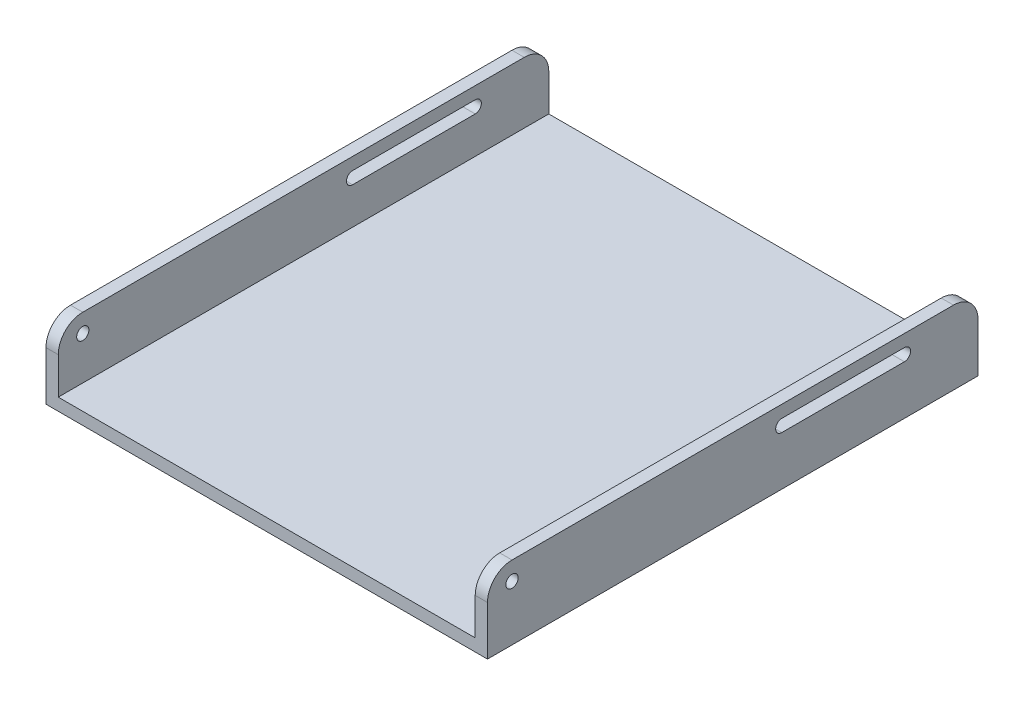
from build123d import *

# Parameters (mm, degrees)
EXTRUDE_THIN1_DEPTH = 200
CUT_EXTRUDE1_DEPTH  = 364
FILLET1_R           = 20
SKETCH3_R           = 5
CUT_EXTRUDE2_DEPTH  = 417.173040934


with BuildPart() as part:
    # Sketch1 → Extrude-Thin1 (new, symmetric)
    with BuildSketch(Plane.XY):
        Polygon((-150, 60), (-150, 0), (210, 0), (210, 60), (200, 60), (200, 10), (-140, 10), (-140, 60), align=None)
    extrude(amount=EXTRUDE_THIN1_DEPTH, both=True)

    # Sketch2 → Cut-Extrude1 (cut)
    with BuildSketch(Plane(origin=(210, 0, 0), x_dir=(0, 0, -1), z_dir=(1, 0, 0))):
        with BuildLine():
            Line((40, 50), (140, 50))
            ThreePointArc((140, 50), (145, 45), (140, 40))
            Line((140, 40), (40, 40))
            ThreePointArc((40, 40), (35, 45), (40, 50))
        make_face()
    extrude(amount=-CUT_EXTRUDE1_DEPTH, mode=Mode.SUBTRACT)

    # Fillet1
    fillet1_edges = [part.edges().sort_by_distance(p)[0] for p in [
        (205, 60, 200),
        (-145, 60, 200),
        (205, 60, -200),
        (-145, 60, -200),
    ]]
    fillet(fillet1_edges, radius=FILLET1_R)

    # Sketch3 → Cut-Extrude2 (cut, through all)
    with BuildSketch(Plane.ZY.offset(150)):
        with Locations((180, 45)):
            Circle(SKETCH3_R)
    extrude(amount=-CUT_EXTRUDE2_DEPTH, mode=Mode.SUBTRACT)


solid = part.part
